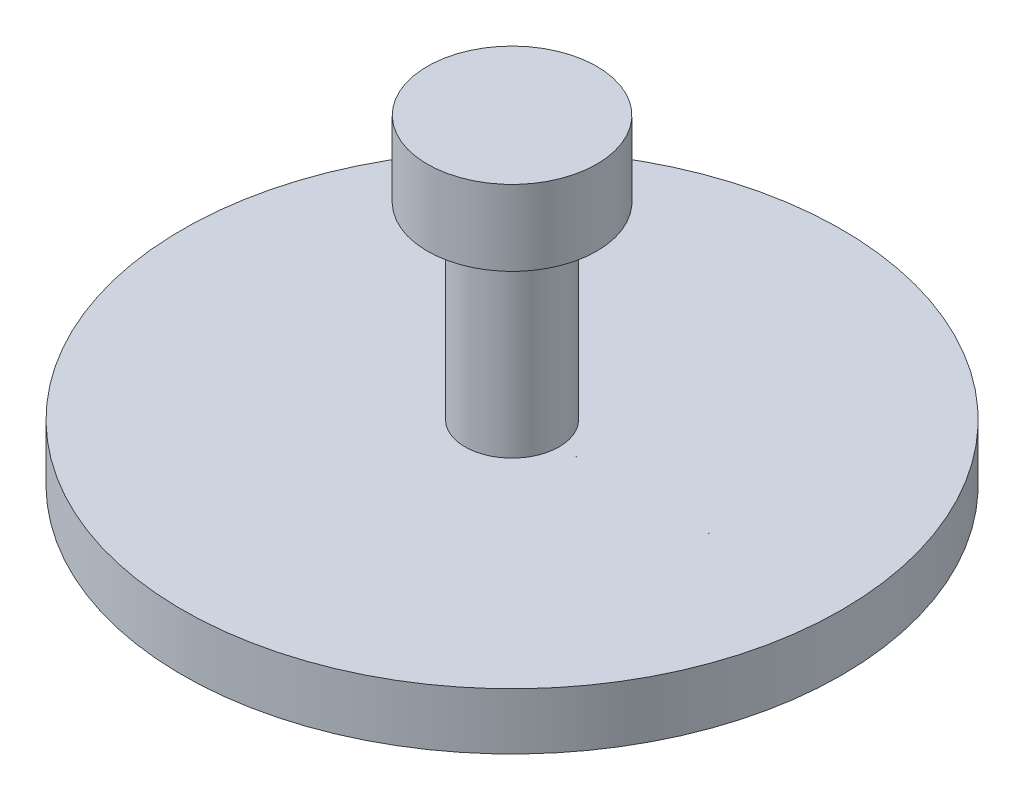
from build123d import *

# Parameters (mm, degrees)
REVOLVE1_ANGLE = 359.999695921


with BuildPart() as part:
    # Sketch1 → Revolve1 (revolve)
    with BuildSketch(Plane.XY):
        Polygon((0, 0), (17.5, 0), (17.5, 3), (2.5, 3), (2.5, 13), (4.5, 13), (4.5, 17), (0, 17), align=None)
    revolve(axis=Axis((0, 0, 0), (0, 1, 0)), revolution_arc=REVOLVE1_ANGLE)


solid = part.part
